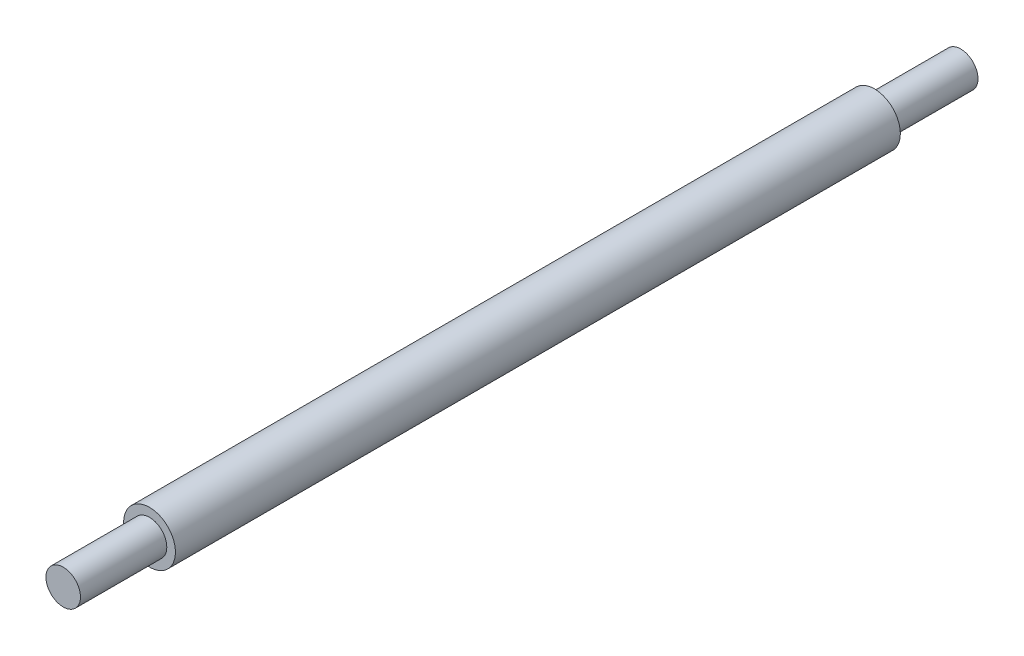
from build123d import *


with BuildPart() as part:
    # Sketch1 → Revolve1 (revolve)
    with BuildSketch(Plane(origin=(0, 0, 0), x_dir=(0, 0, -1), z_dir=(1, 0, 0)), mode=Mode.PRIVATE) as revolve1_sk:
        Polygon((0, 0), (0, 2), (10, 2), (10, 3), (94, 3), (94, 2), (104, 2), (104, 0), align=None)
    revolve(revolve1_sk.sketch.rotate(Axis((0, 0, 0), (0, 0, -1)), 90), axis=Axis((0, 0, 0), (0, 0, -1)))


solid = part.part
